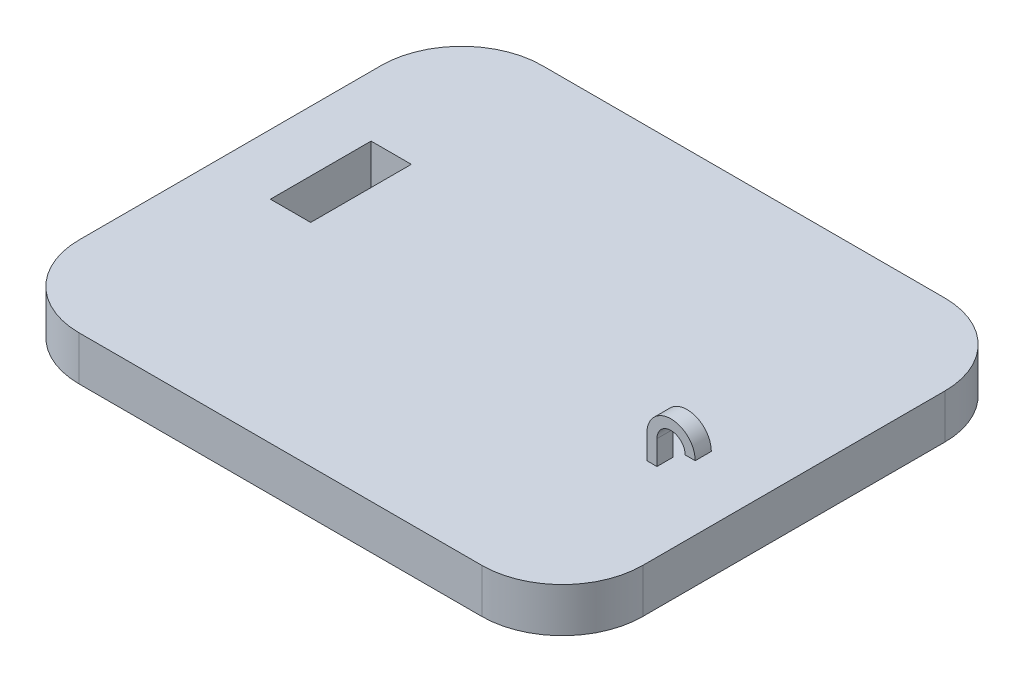
from build123d import *

# Parameters (mm, degrees)
SKETCH2_W           = 140
SKETCH2_H           = 115
BOSS_EXTRUDE1_DEPTH = 11
SKETCH3_W           = 10
SKETCH3_H           = 25
CUT_EXTRUDE1_DEPTH  = 104.662915259
FILLET1_R           = 20
BOSS_EXTRUDE2_DEPTH = 2


with BuildPart() as part:
    # Sketch2 → Boss-Extrude1 (new body)
    with BuildSketch(Plane(origin=(0, 0, 0), x_dir=(1, 0, 0), z_dir=(0, 1, 0))):
        with Locations((-10, -7.5)):
            Rectangle(SKETCH2_W, SKETCH2_H)
    extrude(amount=-BOSS_EXTRUDE1_DEPTH)

    # Sketch3 → Cut-Extrude1 (cut, through all)
    with BuildSketch(Plane(origin=(0, 0, 0), x_dir=(1, 0, 0), z_dir=(0, 1, 0))):
        with Locations((-60, 0)):
            Rectangle(SKETCH3_W, SKETCH3_H)
    extrude(amount=-CUT_EXTRUDE1_DEPTH, mode=Mode.SUBTRACT)

    # Fillet1
    fillet1_edges = [part.edges().sort_by_distance(p)[0] for p in [
        (-80, -5.5, -50),
        (60, -5.5, -50),
        (60, -5.5, 65),
        (-80, -5.5, 65),
    ]]
    fillet(fillet1_edges, radius=FILLET1_R)

    # Sketch4 → Boss-Extrude2 (add, symmetric)
    with BuildSketch(Plane.XY.offset(20)):
        with BuildLine():
            Line((38, 6), (38, 0))
            Line((38, 0), (40.5, 0))
            Line((40.5, 0), (40.5, 6))
            ThreePointArc((40.5, 6), (44, 9.5), (47.5, 6))
            Line((47.5, 6), (50, 6))
            ThreePointArc((50, 6), (44, 12), (38, 6))
        make_face()
    extrude(amount=BOSS_EXTRUDE2_DEPTH, both=True)


solid = part.part
